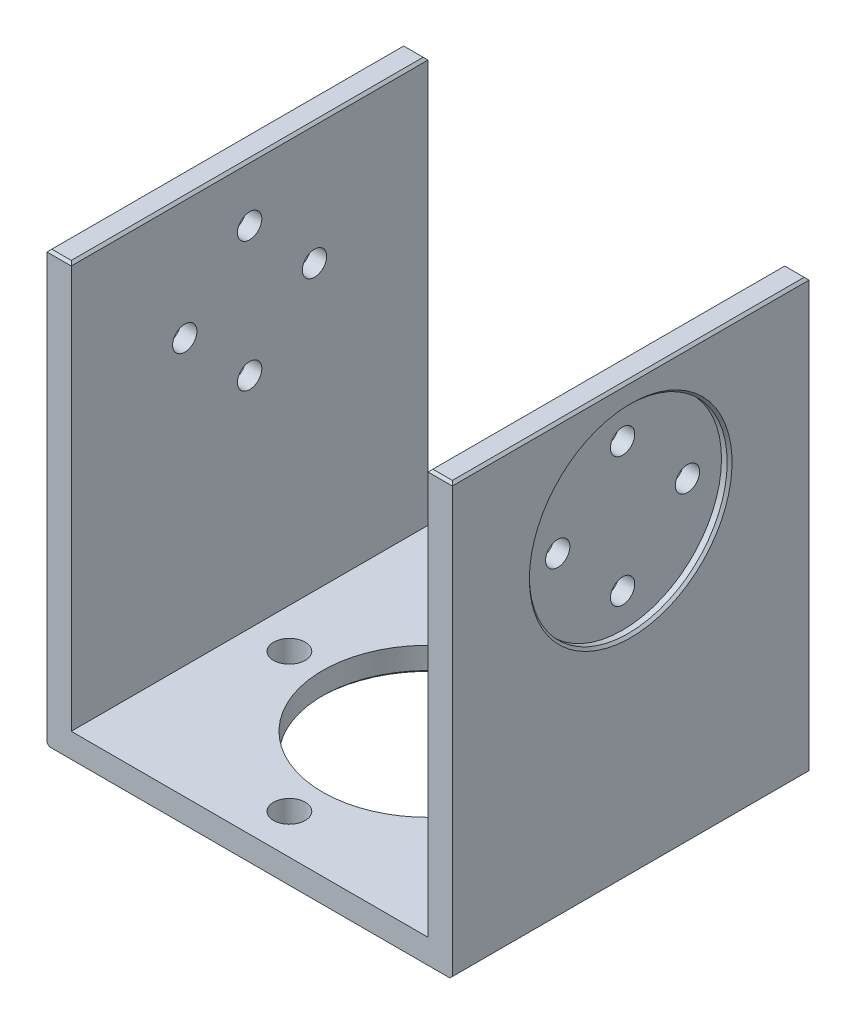
from build123d import *

# Parameters (mm, degrees)
SKETCH_1_W          = 50
SKETCH_1_H          = 44
SKETCH_1_R          = 1.953838975
SKETCH_1_R_2        = 13
EXTRUDE_1_DEPTH     = 3
SKETCH_2_W          = 3
SKETCH_2_H          = 44
EXTRUDE_2_DEPTH     = 50
SKETCH_3_R          = 1.5
CUT_EXTRUDE_1_DEPTH = 77.111759932
SKETCH_4_R          = 12.2
CUT_EXTRUDE_2_DEPTH = 1
CHAMFER_1_SIZE      = 0.3


with BuildPart() as part:
    # 草图1 → 凸台-拉伸1 (new body)
    with BuildSketch(Plane(origin=(0, 0, 0), x_dir=(1, 0, 0), z_dir=(0, 1, 0))):
        Rectangle(SKETCH_1_W, SKETCH_1_H)
        with Locations(Location((0, 17.096091033, 0), (0, 0, 270))):
            Circle(SKETCH_1_R, mode=Mode.SUBTRACT)
        with Locations(Location((17.096091033, 0, 0), (0, 0, 270))):
            Circle(SKETCH_1_R, mode=Mode.SUBTRACT)
        with Locations(Location((0, -17.096091033, 0), (0, 0, 270))):
            Circle(SKETCH_1_R, mode=Mode.SUBTRACT)
        with Locations(Location((-17.096091033, 0, 0), (0, 0, 270))):
            Circle(SKETCH_1_R, mode=Mode.SUBTRACT)
        with Locations(Location((0, 0, 0), (0, 0, 270))):
            Circle(SKETCH_1_R_2, mode=Mode.SUBTRACT)
    extrude(amount=EXTRUDE_1_DEPTH)

    # 草图2 → 凸台-拉伸2 (add)
    with BuildSketch(Plane(origin=(0, 3, 0), x_dir=(1, 0, 0), z_dir=(0, 1, 0))):
        with Locations((-23.5, 0)):
            Rectangle(SKETCH_2_W, SKETCH_2_H)
        with Locations((23.5, 0)):
            Rectangle(SKETCH_2_W, SKETCH_2_H)
    extrude(amount=EXTRUDE_2_DEPTH)

    # 草图3 → 切除-拉伸1 (cut, through all)
    with BuildSketch(Plane.ZY.offset(25)):
        with Locations((0, 46)):
            Circle(SKETCH_3_R)
        with Locations((8, 38)):
            Circle(SKETCH_3_R)
        with Locations((0, 30)):
            Circle(SKETCH_3_R)
        with Locations((-8, 38)):
            Circle(SKETCH_3_R)
    extrude(amount=-CUT_EXTRUDE_1_DEPTH, mode=Mode.SUBTRACT)

    # 草图4 → 切除-拉伸2 (cut)
    with BuildSketch(Plane(origin=(25, 0, 0), x_dir=(0, 0, -1), z_dir=(1, 0, 0))):
        with Locations((0, 38)):
            Circle(SKETCH_4_R)
    cut_extrude_2 = extrude(amount=-CUT_EXTRUDE_2_DEPTH, mode=Mode.SUBTRACT)

    # 镜向1: 切除-拉伸2 across plane
    add(cut_extrude_2.mirror(Plane(origin=(0, 0, 0), x_dir=(0, 0, 1), z_dir=(1, 0, 0))), mode=Mode.SUBTRACT)

    # 倒角1
    chamfer_1_edges = [part.edges().sort_by_distance(p)[0] for p in [
        (-25, 38, 12.2),
        (0, 0, -13),
        (-25, 53, 0),
        (-23.5, 53, 22),
        (-22, 53, 0),
        (-23.5, 53, -22),
        (25, 53, 0),
        (23.5, 53, -22),
        (22, 53, 0),
        (23.5, 53, 22),
        (25, 0, 0),
        (-25, 0, 0),
        (25, 38, 12.2),
    ]]
    chamfer(chamfer_1_edges, length=CHAMFER_1_SIZE)


solid = part.part
